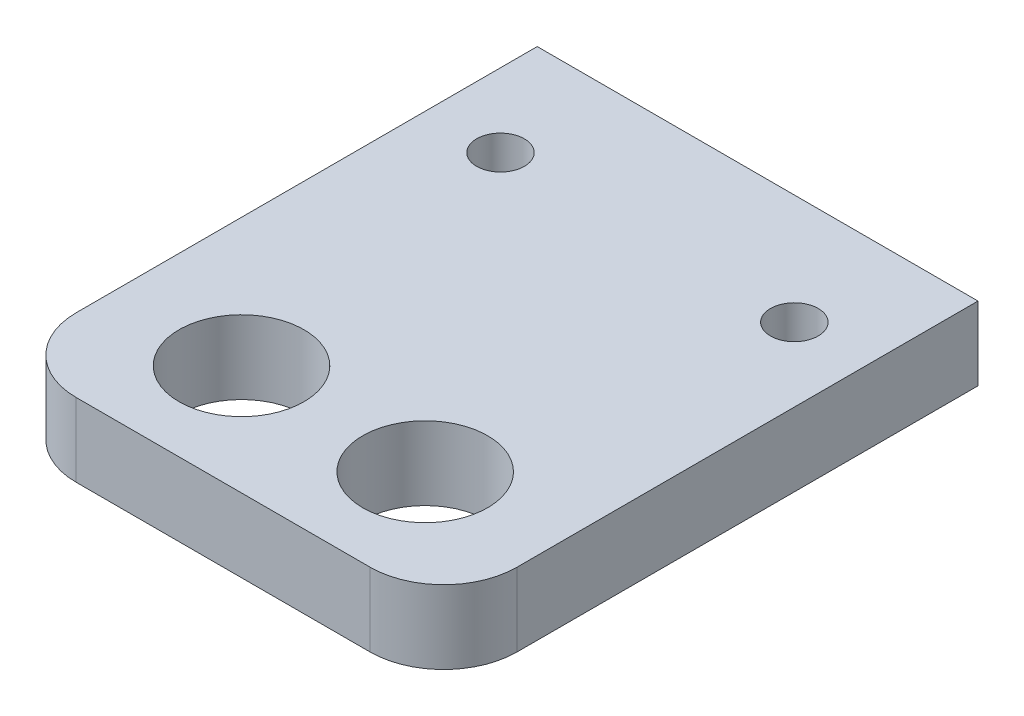
from build123d import *

# Parameters (mm, degrees)
SKETCH10_W          = 60
SKETCH10_H          = 72.75
SKETCH10_R          = 3.25
SKETCH10_R_2        = 8.5
BOSS_EXTRUDE1_DEPTH = 10
FILLET1_R           = 10


with BuildPart() as part:
    # Sketch10 → Boss-Extrude1 (new body)
    with BuildSketch(Plane(origin=(0, 0, 0), x_dir=(1, 0, 0), z_dir=(0, 1, 0))):
        with Locations((30, 36.375)):
            Rectangle(SKETCH10_W, SKETCH10_H)
        with Locations(Location((10, 57.75, 0), (0, 0, 270))):
            Circle(SKETCH10_R, mode=Mode.SUBTRACT)
        with Locations(Location((17.5, 15, 0), (0, 0, 270))):
            Circle(SKETCH10_R_2, mode=Mode.SUBTRACT)
        with Locations(Location((50, 57.75, 0), (0, 0, 270))):
            Circle(SKETCH10_R, mode=Mode.SUBTRACT)
        with Locations(Location((42.5, 15, 0), (0, 0, 270))):
            Circle(SKETCH10_R_2, mode=Mode.SUBTRACT)
    extrude(amount=BOSS_EXTRUDE1_DEPTH)

    # Fillet1
    fillet1_edges = [part.edges().sort_by_distance(p)[0] for p in [
        (60, 5, 0),
        (0, 5, 0),
    ]]
    fillet(fillet1_edges, radius=FILLET1_R)


solid = part.part
